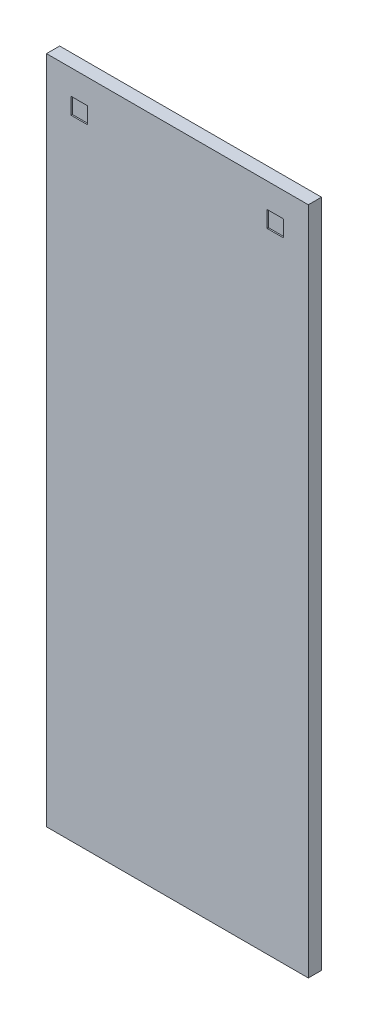
from build123d import *

# Parameters (mm, degrees)
SKETCH1_W           = 398
SKETCH1_H           = 1018
BOSS_EXTRUDE1_DEPTH = 20
SKETCH2_W           = 25
SKETCH2_H           = 25
CUT_EXTRUDE1_DEPTH  = 2


with BuildPart() as part:
    # Sketch1 → Boss-Extrude1 (new body)
    with BuildSketch(Plane.XY):
        Rectangle(SKETCH1_W, SKETCH1_H)
    extrude(amount=BOSS_EXTRUDE1_DEPTH)

    # Sketch2 → Cut-Extrude1 (cut)
    with BuildSketch(Plane.XY.offset(20)):
        with Locations((149, 459)):
            Rectangle(SKETCH2_W, SKETCH2_H)
        with Locations((-149, 459)):
            Rectangle(SKETCH2_W, SKETCH2_H)
    extrude(amount=-CUT_EXTRUDE1_DEPTH, mode=Mode.SUBTRACT)


solid = part.part
